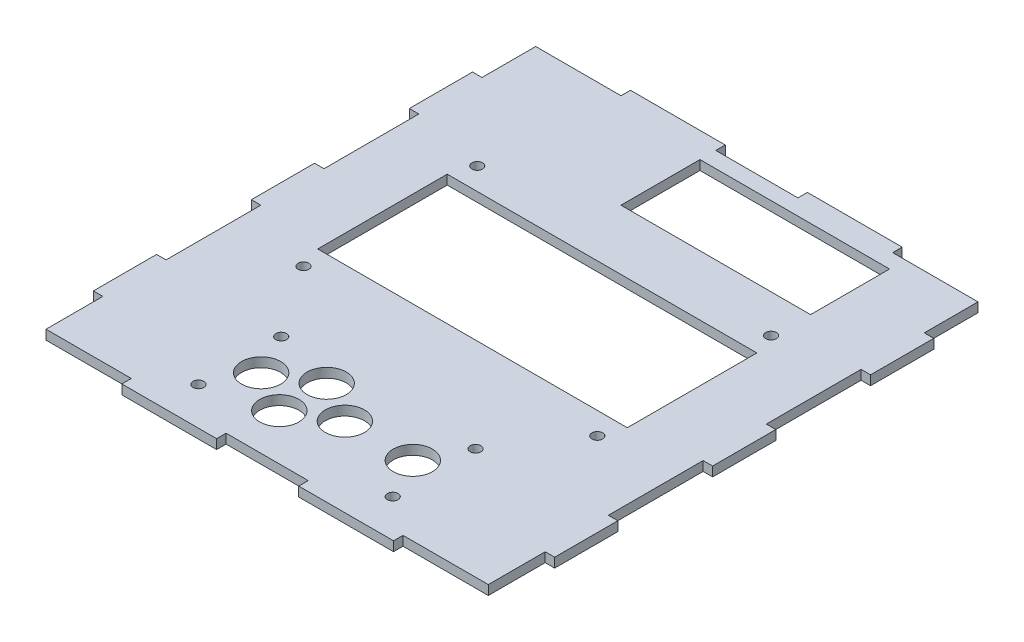
from build123d import *

# Parameters (mm, degrees)
SKETCH1_W           = 146
SKETCH1_H           = 161
BOSS_EXTRUDE1_DEPTH = 3
SKETCH2_W           = 26
SKETCH2_H           = 3
SKETCH2_W_2         = 3
SKETCH2_H_2         = 30
SKETCH2_W_3         = 60
SKETCH2_H_3         = 25
CUT_EXTRUDE1_DEPTH  = 3
SKETCH4_R           = 1.7
SKETCH4_R_2         = 6.2
SKETCH4_W           = 98
SKETCH4_H           = 41
CUT_EXTRUDE2_DEPTH  = 3


with BuildPart() as part:
    # Sketch1 → Boss-Extrude1 (new body)
    with BuildSketch(Plane(origin=(0, 0, 0), x_dir=(1, 0, 0), z_dir=(0, 1, 0))):
        Rectangle(SKETCH1_W, SKETCH1_H)
    extrude(amount=BOSS_EXTRUDE1_DEPTH)

    # Sketch2 → Cut-Extrude1 (cut)
    with BuildSketch(Plane(origin=(0, 3, 0), x_dir=(1, 0, 0), z_dir=(0, 1, 0))):
        with Locations((0, 79)):
            Rectangle(SKETCH2_W, SKETCH2_H)
        with Locations((-71.5, 25.5)):
            Rectangle(SKETCH2_W_2, SKETCH2_H_2)
        Polygon((-73, 80.5), (-73, 60.5), (-70, 60.5), (-70, 77.5), (-43, 77.5), (-43, 80.5), align=None)
        Polygon((73, 80.5), (73, 60.5), (70, 60.5), (70, 77.5), (43, 77.5), (43, 80.5), align=None)
        with Locations((71.5, 25.5)):
            Rectangle(SKETCH2_W_2, SKETCH2_H_2)
        with Locations((-71.5, -24.5)):
            Rectangle(SKETCH2_W_2, SKETCH2_H_2)
        Polygon((-70, -59.5), (-73, -59.5), (-73, -80.5), (-43, -80.5), (-43, -77.5), (-70, -77.5), align=None)
        with Locations((71.5, -24.5)):
            Rectangle(SKETCH2_W_2, SKETCH2_H_2)
        Polygon((70, -59.5), (73, -59.5), (73, -80.5), (70, -80.5), (43, -80.5), (43, -77.5), (70, -77.5), align=None)
        with Locations((0, -79)):
            Rectangle(SKETCH2_W, SKETCH2_H)
        with Locations((17, 60)):
            Rectangle(SKETCH2_W_3, SKETCH2_H_3)
    extrude(amount=-CUT_EXTRUDE1_DEPTH, mode=Mode.SUBTRACT)

    # Sketch4 → Cut-Extrude2 (cut)
    with BuildSketch(Plane(origin=(0, 3, 0), x_dir=(1, 0, 0), z_dir=(0, 1, 0))):
        with Locations(Location((-46.5, 35.5, 0), (0, 0, 270))):
            Circle(SKETCH4_R)
        with Locations(Location((46.5, 35.5, 0), (0, 0, 270))):
            Circle(SKETCH4_R)
        with Locations(Location((46.5, -19.5, 0), (0, 0, 270))):
            Circle(SKETCH4_R)
        with Locations(Location((-46.5, -19.5, 0), (0, 0, 270))):
            Circle(SKETCH4_R)
        with Locations(Location((-30.75, -42.3, 0), (0, 0, 270))):
            Circle(SKETCH4_R)
        with Locations(Location((-30.75, -68.5, 0), (0, 0, 270))):
            Circle(SKETCH4_R)
        with Locations(Location((30.75, -42.3, 0), (0, 0, 270))):
            Circle(SKETCH4_R)
        with Locations(Location((30.75, -68.5, 0), (0, 0, 270))):
            Circle(SKETCH4_R)
        with Locations(Location((-10.75, -47.9, 0), (0, 0, 270))):
            Circle(SKETCH4_R_2)
        with Locations(Location((-24, -55.4, 0), (0, 0, 270))):
            Circle(SKETCH4_R_2)
        with Locations(Location((-10.75, -62.9, 0), (0, 0, 270))):
            Circle(SKETCH4_R_2)
        with Locations(Location((2.5, -55.4, 0), (0, 0, 270))):
            Circle(SKETCH4_R_2)
        with Locations(Location((24, -55.4, 0), (0, 0, 270))):
            Circle(SKETCH4_R_2)
        with Locations((0, 8)):
            Rectangle(SKETCH4_W, SKETCH4_H)
    extrude(amount=-CUT_EXTRUDE2_DEPTH, mode=Mode.SUBTRACT)


solid = part.part
